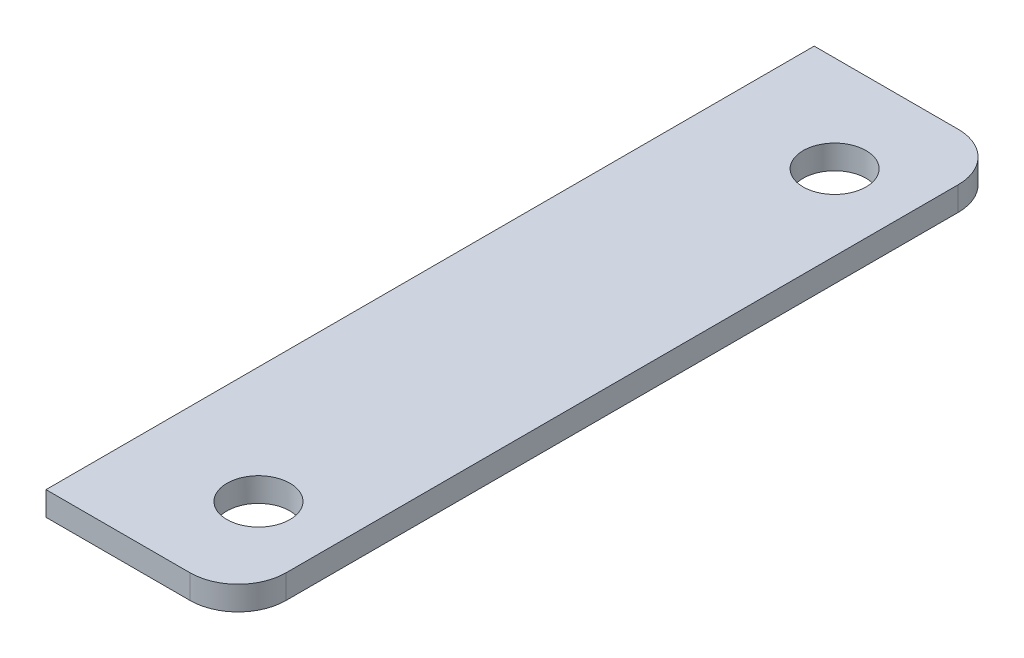
from build123d import *

# Parameters (mm, degrees)
SKETCH1_W           = 25.4
SKETCH1_H           = 101.6
BOSS_EXTRUDE1_DEPTH = 3.175
FILLET2_R           = 6.35
CUT_EXTRUDE1_REACH  = 54.46
SKETCH2_R           = 4.165


with BuildPart() as part:
    # Sketch1 → Boss-Extrude1 (new body)
    with BuildSketch(Plane(origin=(0, 0, 0), x_dir=(1, 0, 0), z_dir=(0, 1, 0))):
        Rectangle(SKETCH1_W, SKETCH1_H)
    extrude(amount=BOSS_EXTRUDE1_DEPTH)

    # Fillet2
    fillet2_edges = [part.edges().sort_by_distance(p)[0] for p in [
        (12.7, 1.5875, 50.8),
        (12.7, 1.5875, -50.8),
    ]]
    fillet(fillet2_edges, radius=FILLET2_R)

    # Sketch2 → Cut-Extrude1 (cut, up to next)
    with BuildSketch(Plane(origin=(0, 3.175, 0), x_dir=(1, 0, 0), z_dir=(0, 1, 0)), mode=Mode.PRIVATE) as cut_extrude1_sk1:
        with Locations(Location((2.7, 38.1, 0), (0, 0, 270))):
            Circle(SKETCH2_R)
    cut_extrude1_tool1 = extrude(cut_extrude1_sk1.sketch, amount=-CUT_EXTRUDE1_REACH, mode=Mode.PRIVATE) & part.part
    # Sketch2 → Cut-Extrude1 (cut, up to next)
    with BuildSketch(Plane(origin=(0, 3.175, 0), x_dir=(1, 0, 0), z_dir=(0, 1, 0)), mode=Mode.PRIVATE) as cut_extrude1_sk2:
        with Locations(Location((2.7, -38.1, 0), (0, 0, 270))):
            Circle(SKETCH2_R)
    cut_extrude1_tool2 = extrude(cut_extrude1_sk2.sketch, amount=-CUT_EXTRUDE1_REACH, mode=Mode.PRIVATE) & part.part
    add(cut_extrude1_tool1.solids().sort_by_distance((2.7, 3.175, -38.1))[0], mode=Mode.SUBTRACT)
    add(cut_extrude1_tool2.solids().sort_by_distance((2.7, 3.175, 38.1))[0], mode=Mode.SUBTRACT)


solid = part.part
